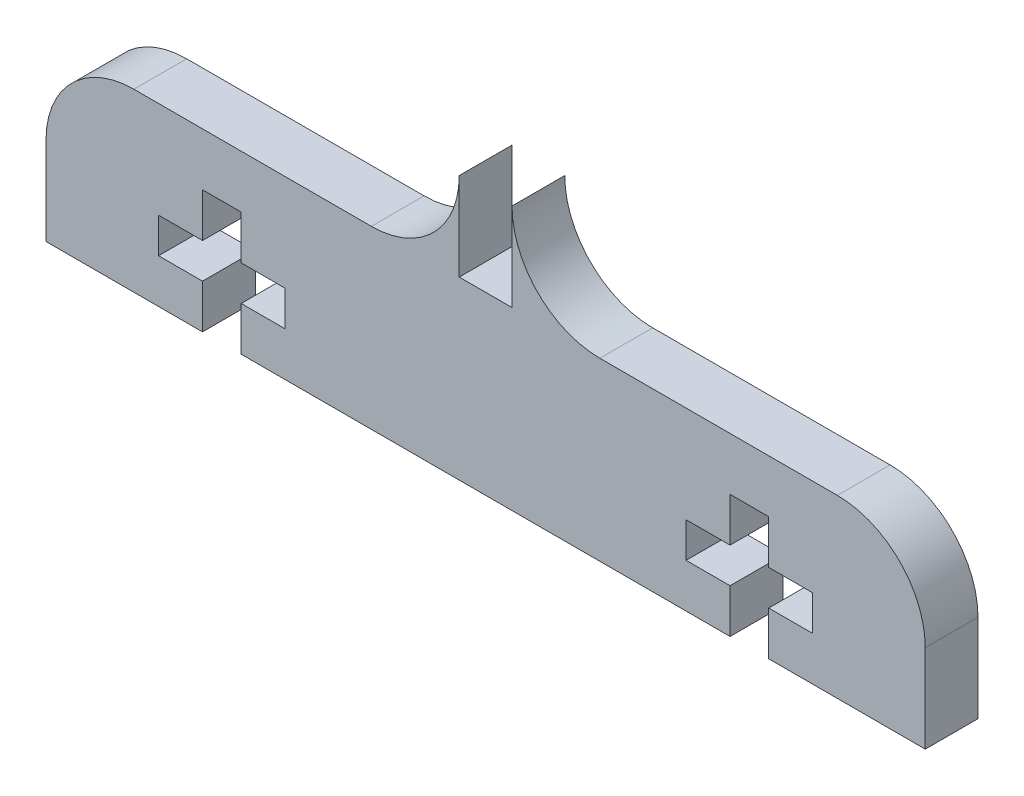
from build123d import *

# Parameters (mm, degrees)
BOSS_EXTRUDE1_DEPTH = 3
FILLET1_R           = 5


with BuildPart() as part:
    # Sketch1 → Boss-Extrude1 (new body)
    with BuildSketch(Plane.XY):
        with BuildLine():
            Line((-25, -5), (-16.1, -5))
            Line((-16.1, -5), (-16.1, -2.5))
            Line((-16.1, -2.5), (-18.6, -2.5))
            Line((-18.6, -2.5), (-18.6, -0.5))
            Line((-18.6, -0.5), (-16.1, -0.5))
            Line((-16.1, -0.5), (-16.1, 2))
            Line((-16.1, 2), (-13.9, 2))
            Line((-13.9, 2), (-13.9, -0.5))
            Line((-13.9, -0.5), (-11.4, -0.5))
            Line((-11.4, -0.5), (-11.4, -2.5))
            Line((-11.4, -2.5), (-13.9, -2.5))
            Line((-13.9, -2.5), (-13.9, -5))
            Line((-13.9, -5), (13.9, -5))
            Line((13.9, -5), (13.9, -2.5))
            Line((13.9, -2.5), (11.4, -2.5))
            Line((11.4, -2.5), (11.4, -0.5))
            Line((11.4, -0.5), (13.9, -0.5))
            Line((13.9, -0.5), (13.9, 2))
            Line((13.9, 2), (16.1, 2))
            Line((16.1, 2), (16.1, -0.5))
            Line((16.1, -0.5), (18.6, -0.5))
            Line((18.6, -0.5), (18.6, -2.5))
            Line((18.6, -2.5), (16.1, -2.5))
            Line((16.1, -2.5), (16.1, -5))
            Line((16.1, -5), (25, -5))
            Line((25, -5), (25, 5))
            Line((25, 5), (6.5, 5))
            ThreePointArc((6.5, 5), (2.964466094, 6.464466094), (1.5, 10))
            Line((1.5, 10), (1.5, 5))
            Line((1.5, 5), (-1.5, 5))
            Line((-1.5, 5), (-1.5, 10))
            ThreePointArc((-1.5, 10), (-2.964466094, 6.464466094), (-6.5, 5))
            Line((-6.5, 5), (-25, 5))
            Line((-25, 5), (-25, -5))
        make_face()
    extrude(amount=BOSS_EXTRUDE1_DEPTH)

    # Fillet1
    fillet1_edges = [part.edges().sort_by_distance(p)[0] for p in [
        (25, 5, 1.5),
        (-25, 5, 1.5),
    ]]
    fillet(fillet1_edges, radius=FILLET1_R)


solid = part.part
